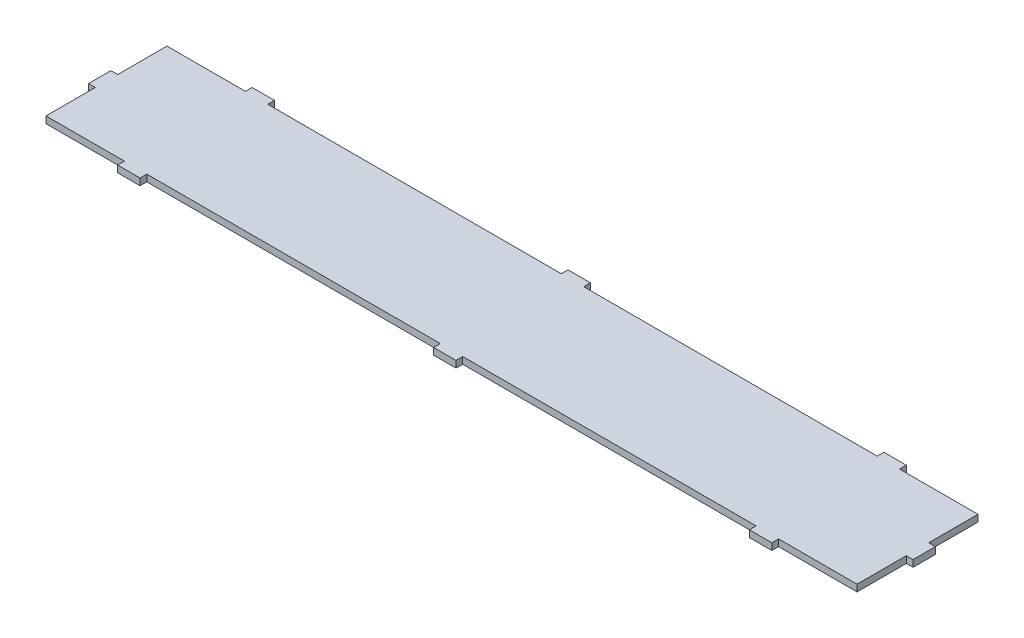
from build123d import *

# Parameters (mm, degrees)
BOSS_EXTRUDE1_DEPTH = 3


with BuildPart() as part:
    # Sketch1 → Boss-Extrude1 (new body)
    with BuildSketch(Plane(origin=(0, 0, 0), x_dir=(1, 0, 0), z_dir=(0, 1, 0))):
        Polygon((-181, 27), (-181, 5), (-184, 5), (-184, -5), (-181, -5), (-181, -27), (-146, -27), (-146, -30), (-136, -30), (-136, -27), (-5, -27), (-5, -30), (5, -30), (5, -27), (136, -27), (136, -30), (146, -30), (146, -27), (181, -27), (181, -5), (184, -5), (184, 5), (181, 5), (181, 27), (146, 27), (146, 30), (136, 30), (136, 27), (5, 27), (5, 30), (-5, 30), (-5, 27), (-136, 27), (-136, 30), (-146, 30), (-146, 27), align=None)
    extrude(amount=BOSS_EXTRUDE1_DEPTH)


solid = part.part
